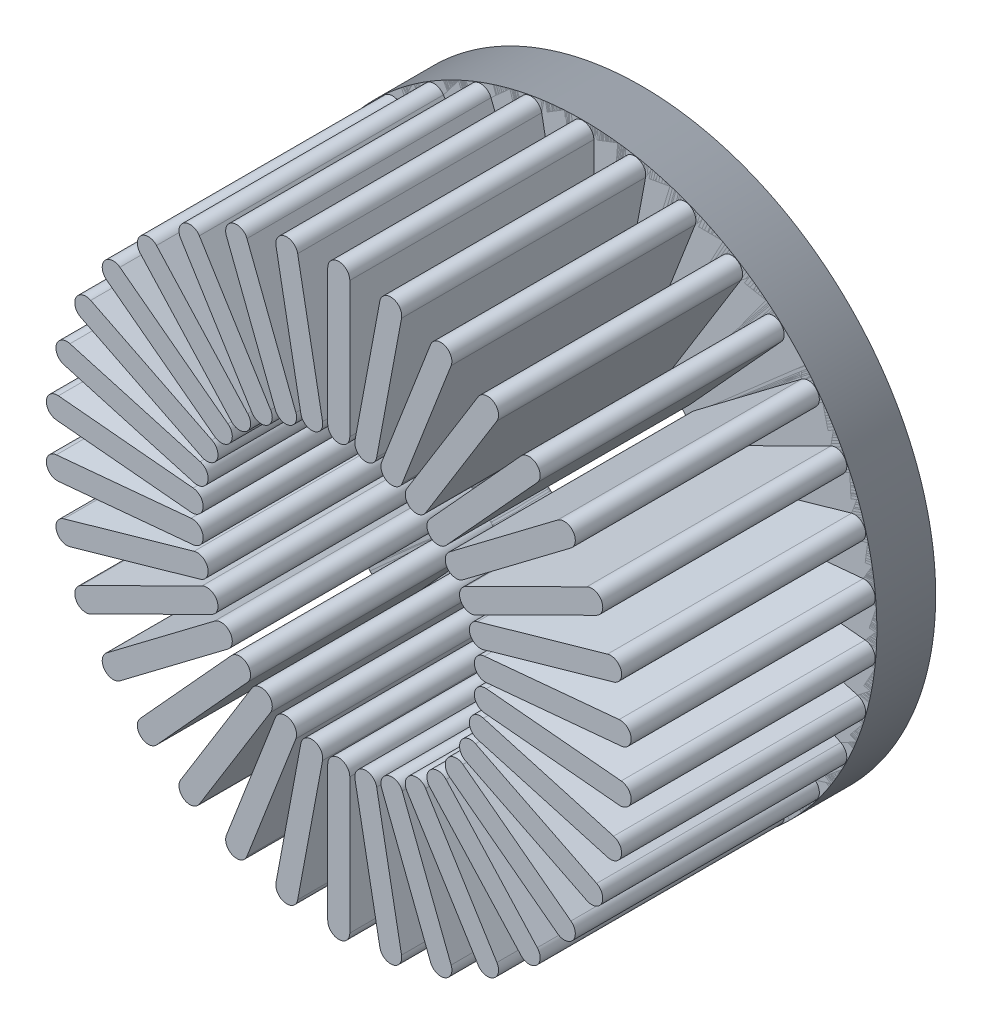
from build123d import *

# Parameters (mm, degrees)
SKETCH2_R           = 20
SKETCH2_R_2         = 9.3
BOSS_EXTRUDE1_DEPTH = 4
BOSS_EXTRUDE2_DEPTH = 16.6
CIRPATTERN1_COUNT   = 34


with BuildPart() as part:
    # Sketch2 → Boss-Extrude1 (new body)
    with BuildSketch(Plane.XY):
        Circle(SKETCH2_R)
        Circle(SKETCH2_R_2, mode=Mode.SUBTRACT)
    extrude(amount=BOSS_EXTRUDE1_DEPTH)

    # Sketch3 → Boss-Extrude2 (add)
    with BuildSketch(Plane.XY.offset(4)):
        with BuildLine():
            Line((0.75, 19.222075304), (0.75, 10.016075304))
            ThreePointArc((0.75, 10.016075304), (0, 9.266075304), (-0.75, 10.016075304))
            Line((-0.75, 10.016075304), (-0.75, 19.222075304))
            ThreePointArc((-0.75, 19.222075304), (0, 19.972075304), (0.75, 19.222075304))
        make_face()
    extrude(amount=BOSS_EXTRUDE2_DEPTH)


with BuildPart() as cirpattern1_1:
    # CirPattern1: pattern copy
    add(part.part.rotate(Axis((0, 0, 0), (0, 0, 1)), 1 * 360 / CIRPATTERN1_COUNT))


with BuildPart() as cirpattern1_2:
    # CirPattern1: pattern copy
    add(part.part.rotate(Axis((0, 0, 0), (0, 0, 1)), 2 * 360 / CIRPATTERN1_COUNT))


with BuildPart() as cirpattern1_3:
    # CirPattern1: pattern copy
    add(part.part.rotate(Axis((0, 0, 0), (0, 0, 1)), 3 * 360 / CIRPATTERN1_COUNT))


with BuildPart() as cirpattern1_4:
    # CirPattern1: pattern copy
    add(part.part.rotate(Axis((0, 0, 0), (0, 0, 1)), 4 * 360 / CIRPATTERN1_COUNT))


with BuildPart() as cirpattern1_5:
    # CirPattern1: pattern copy
    add(part.part.rotate(Axis((0, 0, 0), (0, 0, 1)), 5 * 360 / CIRPATTERN1_COUNT))


with BuildPart() as cirpattern1_6:
    # CirPattern1: pattern copy
    add(part.part.rotate(Axis((0, 0, 0), (0, 0, 1)), 6 * 360 / CIRPATTERN1_COUNT))


with BuildPart() as cirpattern1_7:
    # CirPattern1: pattern copy
    add(part.part.rotate(Axis((0, 0, 0), (0, 0, 1)), 7 * 360 / CIRPATTERN1_COUNT))


with BuildPart() as cirpattern1_8:
    # CirPattern1: pattern copy
    add(part.part.rotate(Axis((0, 0, 0), (0, 0, 1)), 8 * 360 / CIRPATTERN1_COUNT))


with BuildPart() as cirpattern1_9:
    # CirPattern1: pattern copy
    add(part.part.rotate(Axis((0, 0, 0), (0, 0, 1)), 9 * 360 / CIRPATTERN1_COUNT))


with BuildPart() as cirpattern1_10:
    # CirPattern1: pattern copy
    add(part.part.rotate(Axis((0, 0, 0), (0, 0, 1)), 10 * 360 / CIRPATTERN1_COUNT))


with BuildPart() as cirpattern1_11:
    # CirPattern1: pattern copy
    add(part.part.rotate(Axis((0, 0, 0), (0, 0, 1)), 11 * 360 / CIRPATTERN1_COUNT))


with BuildPart() as cirpattern1_12:
    # CirPattern1: pattern copy
    add(part.part.rotate(Axis((0, 0, 0), (0, 0, 1)), 12 * 360 / CIRPATTERN1_COUNT))


with BuildPart() as cirpattern1_13:
    # CirPattern1: pattern copy
    add(part.part.rotate(Axis((0, 0, 0), (0, 0, 1)), 13 * 360 / CIRPATTERN1_COUNT))


with BuildPart() as cirpattern1_14:
    # CirPattern1: pattern copy
    add(part.part.rotate(Axis((0, 0, 0), (0, 0, 1)), 14 * 360 / CIRPATTERN1_COUNT))


with BuildPart() as cirpattern1_15:
    # CirPattern1: pattern copy
    add(part.part.rotate(Axis((0, 0, 0), (0, 0, 1)), 15 * 360 / CIRPATTERN1_COUNT))


with BuildPart() as cirpattern1_16:
    # CirPattern1: pattern copy
    add(part.part.rotate(Axis((0, 0, 0), (0, 0, 1)), 16 * 360 / CIRPATTERN1_COUNT))


with BuildPart() as cirpattern1_17:
    # CirPattern1: pattern copy
    add(part.part.rotate(Axis((0, 0, 0), (0, 0, 1)), 17 * 360 / CIRPATTERN1_COUNT))


with BuildPart() as cirpattern1_18:
    # CirPattern1: pattern copy
    add(part.part.rotate(Axis((0, 0, 0), (0, 0, 1)), 18 * 360 / CIRPATTERN1_COUNT))


with BuildPart() as cirpattern1_19:
    # CirPattern1: pattern copy
    add(part.part.rotate(Axis((0, 0, 0), (0, 0, 1)), 19 * 360 / CIRPATTERN1_COUNT))


with BuildPart() as cirpattern1_20:
    # CirPattern1: pattern copy
    add(part.part.rotate(Axis((0, 0, 0), (0, 0, 1)), 20 * 360 / CIRPATTERN1_COUNT))


with BuildPart() as cirpattern1_21:
    # CirPattern1: pattern copy
    add(part.part.rotate(Axis((0, 0, 0), (0, 0, 1)), 21 * 360 / CIRPATTERN1_COUNT))


with BuildPart() as cirpattern1_22:
    # CirPattern1: pattern copy
    add(part.part.rotate(Axis((0, 0, 0), (0, 0, 1)), 22 * 360 / CIRPATTERN1_COUNT))


with BuildPart() as cirpattern1_23:
    # CirPattern1: pattern copy
    add(part.part.rotate(Axis((0, 0, 0), (0, 0, 1)), 23 * 360 / CIRPATTERN1_COUNT))


with BuildPart() as cirpattern1_24:
    # CirPattern1: pattern copy
    add(part.part.rotate(Axis((0, 0, 0), (0, 0, 1)), 24 * 360 / CIRPATTERN1_COUNT))


with BuildPart() as cirpattern1_25:
    # CirPattern1: pattern copy
    add(part.part.rotate(Axis((0, 0, 0), (0, 0, 1)), 25 * 360 / CIRPATTERN1_COUNT))


with BuildPart() as cirpattern1_26:
    # CirPattern1: pattern copy
    add(part.part.rotate(Axis((0, 0, 0), (0, 0, 1)), 26 * 360 / CIRPATTERN1_COUNT))


with BuildPart() as cirpattern1_27:
    # CirPattern1: pattern copy
    add(part.part.rotate(Axis((0, 0, 0), (0, 0, 1)), 27 * 360 / CIRPATTERN1_COUNT))


with BuildPart() as cirpattern1_28:
    # CirPattern1: pattern copy
    add(part.part.rotate(Axis((0, 0, 0), (0, 0, 1)), 28 * 360 / CIRPATTERN1_COUNT))


with BuildPart() as cirpattern1_29:
    # CirPattern1: pattern copy
    add(part.part.rotate(Axis((0, 0, 0), (0, 0, 1)), 29 * 360 / CIRPATTERN1_COUNT))


with BuildPart() as cirpattern1_30:
    # CirPattern1: pattern copy
    add(part.part.rotate(Axis((0, 0, 0), (0, 0, 1)), 30 * 360 / CIRPATTERN1_COUNT))


with BuildPart() as cirpattern1_31:
    # CirPattern1: pattern copy
    add(part.part.rotate(Axis((0, 0, 0), (0, 0, 1)), 31 * 360 / CIRPATTERN1_COUNT))


with BuildPart() as cirpattern1_32:
    # CirPattern1: pattern copy
    add(part.part.rotate(Axis((0, 0, 0), (0, 0, 1)), 32 * 360 / CIRPATTERN1_COUNT))


with BuildPart() as cirpattern1_33:
    # CirPattern1: pattern copy
    add(part.part.rotate(Axis((0, 0, 0), (0, 0, 1)), 33 * 360 / CIRPATTERN1_COUNT))


solid = Compound([part.part, cirpattern1_1.part, cirpattern1_2.part, cirpattern1_3.part, cirpattern1_4.part, cirpattern1_5.part, cirpattern1_6.part, cirpattern1_7.part, cirpattern1_8.part, cirpattern1_9.part, cirpattern1_10.part, cirpattern1_11.part, cirpattern1_12.part, cirpattern1_13.part, cirpattern1_14.part, cirpattern1_15.part, cirpattern1_16.part, cirpattern1_17.part, cirpattern1_18.part, cirpattern1_19.part, cirpattern1_20.part, cirpattern1_21.part, cirpattern1_22.part, cirpattern1_23.part, cirpattern1_24.part, cirpattern1_25.part, cirpattern1_26.part, cirpattern1_27.part, cirpattern1_28.part, cirpattern1_29.part, cirpattern1_30.part, cirpattern1_31.part, cirpattern1_32.part, cirpattern1_33.part])
